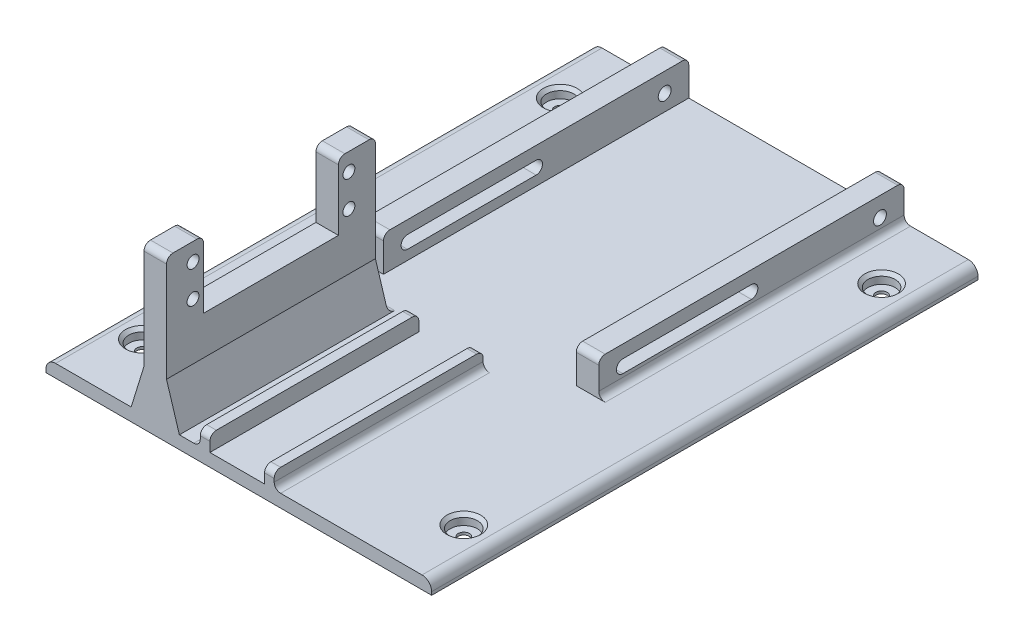
from build123d import *

# Parameters (mm, degrees)
SKETCH_1_W          = 120
SKETCH_1_H          = 170
EXTRUDE_1_DEPTH     = 4
SKETCH_2_R          = 1.75
CUT_EXTRUDE_1_DEPTH = 107.434596542
SKETCH_3_W          = 7
SKETCH_3_H          = 95
EXTRUDE_2_DEPTH     = 11
SKETCH_4_R          = 2
CUT_EXTRUDE_3_DEPTH = 131.46218131
SKETCH_5_W          = 7
SKETCH_5_H          = 65
EXTRUDE_3_DEPTH     = 46
SKETCH_7_R          = 1.85
SKETCH_7_W          = 42
SKETCH_7_H          = 21
CUT_EXTRUDE_4_DEPTH = 134.77828954
SKETCH_9_W          = 3
SKETCH_9_H          = 65
EXTRUDE_4_DEPTH     = 5
EXTRUDE_5_DEPTH     = 65
SKETCH_13_R         = 4.25
CUT_EXTRUDE_5_DEPTH = 3.2
FILLET_3_R          = 3
FILLET_5_R          = 2
CHAMFER_1_SIZE      = 1
FILLET_6_R          = 2


with BuildPart() as part:
    # 草图1 → 凸台-拉伸1 (new body)
    with BuildSketch(Plane(origin=(0, 0, 0), x_dir=(1, 0, 0), z_dir=(0, 1, 0))):
        with Locations((2.657342657, 0.944055944)):
            Rectangle(SKETCH_1_W, SKETCH_1_H)
    extrude(amount=EXTRUDE_1_DEPTH)

    # 草图2 → 切除-拉伸1 (cut, through all)
    with BuildSketch(Plane(origin=(0, 4, 0), x_dir=(1, 0, 0), z_dir=(0, 1, 0))):
        with Locations(Location((-47.342657343, 65.944055944, 0), (0, 0, 270))):
            Circle(SKETCH_2_R)
        with Locations(Location((-47.342657343, -64.055944056, 0), (0, 0, 90))):
            Circle(SKETCH_2_R)
        with Locations(Location((52.657342657, -64.055944056, 0), (0, 0, 270))):
            Circle(SKETCH_2_R)
        with Locations(Location((52.657342657, 65.944055944, 0), (0, 0, 90))):
            Circle(SKETCH_2_R)
    extrude(amount=-CUT_EXTRUDE_1_DEPTH, mode=Mode.SUBTRACT)

    # 草图3 → 凸台-拉伸2 (add)
    with BuildSketch(Plane(origin=(0, 4, 0), x_dir=(1, 0, 0), z_dir=(0, 1, 0))):
        with Locations((-30.842657343, 38.444055944)):
            Rectangle(SKETCH_3_W, SKETCH_3_H)
        with Locations((36.157342657, 38.444055944)):
            Rectangle(SKETCH_3_W, SKETCH_3_H)
    extrude(amount=EXTRUDE_2_DEPTH)

    # 草图4 → 切除-拉伸3 (cut, through all)
    with BuildSketch(Plane.ZY.offset(34.342657343)):
        with Locations((-78.444055944, 9)):
            Circle(SKETCH_4_R)
        with BuildLine():
            Line((-38.444055944, 11), (1.555944056, 11))
            ThreePointArc((1.555944056, 11), (3.555944056, 9), (1.555944056, 7))
            Line((1.555944056, 7), (-38.444055944, 7))
            ThreePointArc((-38.444055944, 7), (-40.444055944, 9), (-38.444055944, 11))
        make_face()
    extrude(amount=-CUT_EXTRUDE_3_DEPTH, mode=Mode.SUBTRACT)

    # 草图5 → 凸台-拉伸3 (add)
    with BuildSketch(Plane(origin=(0, 4, 0), x_dir=(1, 0, 0), z_dir=(0, 1, 0))):
        with Locations((-23.342657343, -51.555944056)):
            Rectangle(SKETCH_5_W, SKETCH_5_H)
    extrude(amount=EXTRUDE_3_DEPTH)

    # 草图7 → 切除-拉伸4 (cut, through all)
    with BuildSketch(Plane.ZY.offset(26.842657343)):
        with Locations((27.305944056, 34.5)):
            Circle(SKETCH_7_R)
        with Locations((27.305944056, 44.5)):
            Circle(SKETCH_7_R)
        with Locations((75.805944056, 44.5)):
            Circle(SKETCH_7_R)
        with Locations((75.805944056, 34.5)):
            Circle(SKETCH_7_R)
        with Locations((51.555944056, 39.5)):
            Rectangle(SKETCH_7_W, SKETCH_7_H)
    extrude(amount=-CUT_EXTRUDE_4_DEPTH, mode=Mode.SUBTRACT)

    # 草图9 → 凸台-拉伸4 (add)
    with BuildSketch(Plane(origin=(0, 4, 0), x_dir=(1, 0, 0), z_dir=(0, 1, 0))):
        with Locations((-7.842657343, -51.555944056)):
            Rectangle(SKETCH_9_W, SKETCH_9_H)
        with Locations((12.157342657, -51.555944056)):
            Rectangle(SKETCH_9_W, SKETCH_9_H)
    extrude(amount=EXTRUDE_4_DEPTH)

    # 草图11 → 凸台-拉伸5 (add)
    with BuildSketch(Plane(origin=(-26.842657343, 4, 84.055944056), x_dir=(1, 0, 0), z_dir=(0, 0, 1))):
        Polygon((0, 12.976482023), (-4, 0), (0, 0), align=None)
        Polygon((7, 0), (11, 0), (7, 12.976482023), align=None)
    extrude(amount=-EXTRUDE_5_DEPTH)

    # 草图13 → 切除-拉伸5 (cut)
    with BuildSketch(Plane(origin=(0, 4, 0), x_dir=(1, 0, 0), z_dir=(0, 1, 0))):
        with Locations(Location((-47.342657343, 65.944055944, 0), (0, 0, 270))):
            Circle(SKETCH_13_R)
        with Locations(Location((52.657342657, 65.944055944, 0), (0, 0, 90))):
            Circle(SKETCH_13_R)
        with Locations(Location((52.657342657, -64.055944056, 0), (0, 0, 270))):
            Circle(SKETCH_13_R)
        with Locations(Location((-47.342657343, -64.055944056, 0), (0, 0, 90))):
            Circle(SKETCH_13_R)
    extrude(amount=-CUT_EXTRUDE_5_DEPTH, mode=Mode.SUBTRACT)

    # 圆角3
    fillet_3_edges = [part.edges().sort_by_distance(p)[0] for p in [
        (-57.342657343, 4, -0.944055944),
        (62.657342657, 4, -0.944055944),
    ]]
    fillet(fillet_3_edges, radius=FILLET_3_R)

    # 圆角5
    fillet_5_edges = [part.edges().sort_by_distance(p)[0] for p in [
        (-9.342657343, 4, 51.555944056),
        (13.657342657, 4, 51.555944056),
    ]]
    fillet(fillet_5_edges, radius=FILLET_5_R)

    # 倒角1
    chamfer_1_edges = [part.edges().sort_by_distance(p)[0] for p in [
        (-47.342657343, 4, 68.305944056),
        (52.657342657, 4, 59.805944056),
        (52.657342657, 4, -61.694055944),
        (-47.342657343, 4, -70.194055944),
    ]]
    chamfer(chamfer_1_edges, length=CHAMFER_1_SIZE)

    # 圆角6
    fillet_6_edges = [part.edges().sort_by_distance(p)[0] for p in [
        (-23.342657343, 4, 19.055944056),
        (-23.342657343, 50, 84.055944056),
        (-23.342657343, 50, 19.055944056),
        (-23.342657343, 50, 72.555944056),
        (-23.342657343, 50, 30.555944056),
        (-7.842657343, 9, 84.055944056),
        (-7.842657343, 9, 19.055944056),
        (12.157342657, 9, 84.055944056),
        (12.157342657, 9, 19.055944056),
        (-34.342657343, 4, -38.444055944),
        (-30.842657343, 15, 9.055944056),
        (-30.842657343, 15, -85.944055944),
        (36.157342657, 15, 9.055944056),
        (36.157342657, 15, -85.944055944),
        (39.657342657, 4, -38.444055944),
    ]]
    fillet(fillet_6_edges, radius=FILLET_6_R)


solid = part.part
